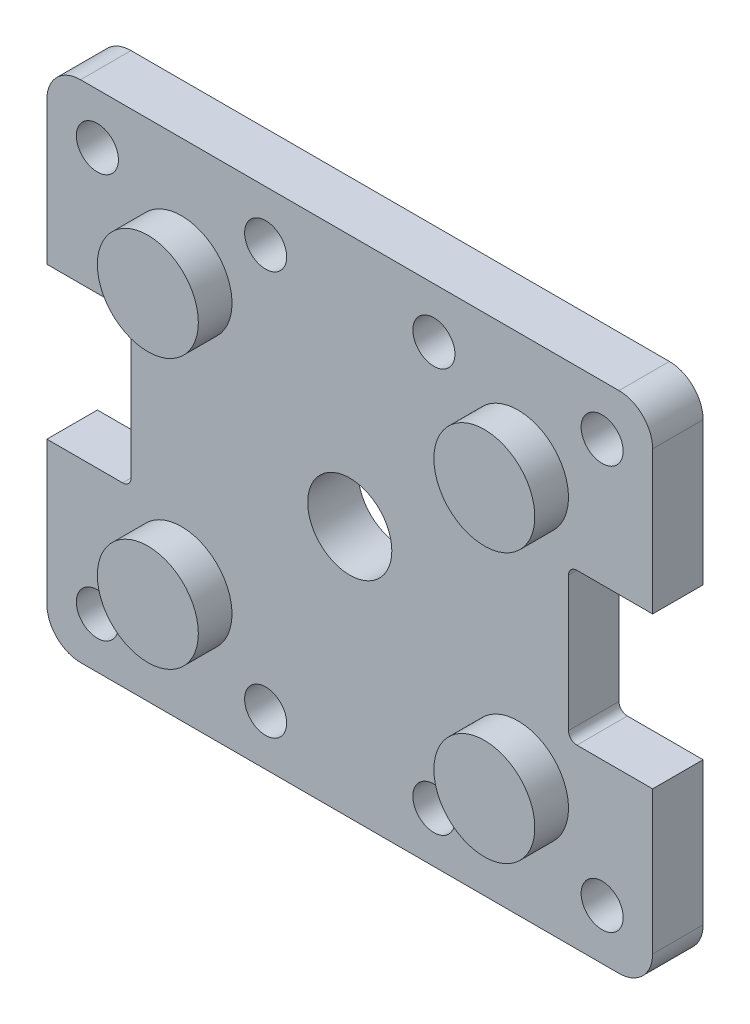
from build123d import *

# Parameters (mm, degrees)
SKETCH_1_W          = 36
SKETCH_1_H          = 30
EXTRUDE_1_DEPTH     = 3
SKETCH_3_R          = 3
EXTRUDE_2_DEPTH     = 2
SKETCH_4_W          = 5
SKETCH_4_H          = 9
CUT_EXTRUDE_2_DEPTH = 47.957427527
HOLE_WIZARD_M6_1_D  = 5
FILLET_1_R          = 0.5
MM_1_D              = 2.5
FILLET_2_R          = 2


with BuildPart() as part:
    # 草图1 → 凸台-拉伸1 (new body)
    with BuildSketch(Plane.XY):
        with Locations((18, 15)):
            Rectangle(SKETCH_1_W, SKETCH_1_H)
    extrude(amount=EXTRUDE_1_DEPTH)

    # 草图3 → 凸台-拉伸2 (add)
    with BuildSketch(Plane.XY.offset(3)):
        with Locations(Location((8, 23, 0), (0, 0, 180))):
            Circle(SKETCH_3_R)
        with Locations(Location((8, 7, 0), (0, 0, 180))):
            Circle(SKETCH_3_R)
        with Locations(Location((28, 7, 0), (0, 0, 180))):
            Circle(SKETCH_3_R)
        with Locations(Location((28, 23, 0), (0, 0, 180))):
            Circle(SKETCH_3_R)
    extrude(amount=EXTRUDE_2_DEPTH)

    # 草图4 → 切除-拉伸2 (cut, through all)
    with BuildSketch(Plane.XY.offset(3)):
        with Locations((33.5, 15)):
            Rectangle(SKETCH_4_W, SKETCH_4_H)
        with Locations((2.5, 15)):
            Rectangle(SKETCH_4_W, SKETCH_4_H)
    extrude(amount=-CUT_EXTRUDE_2_DEPTH, mode=Mode.SUBTRACT)

    # M6 螺纹孔1 (through all)
    with Locations(Plane(origin=(18, 15, 3), x_dir=(1, 0, 0), z_dir=(0, 0, 1))):
        with Locations((0, 0)):
            Hole(HOLE_WIZARD_M6_1_D / 2)

    # 圆角1
    fillet_1_edges = [part.edges().sort_by_distance(p)[0] for p in [
        (5, 19.5, 1.5),
        (5, 10.5, 1.5),
        (31, 10.5, 1.5),
        (31, 19.5, 1.5),
    ]]
    fillet(fillet_1_edges, radius=FILLET_1_R)

    # 大小mm 暗销孔1 (through all)
    with Locations(Plane(origin=(3, 27, 3), x_dir=(1, 0, 0), z_dir=(0, 0, 1))):
        with Locations((0, 0), (10, 0), (20, 0), (30, 0), (30, -24), (20, -24), (10, -24), (0, -24)):
            Hole(MM_1_D / 2)

    # 圆角2
    fillet_2_edges = [part.edges().sort_by_distance(p)[0] for p in [
        (0, 30, 1.5),
        (36, 30, 1.5),
        (36, 0, 1.5),
        (0, 0, 1.5),
    ]]
    fillet(fillet_2_edges, radius=FILLET_2_R)


solid = part.part
